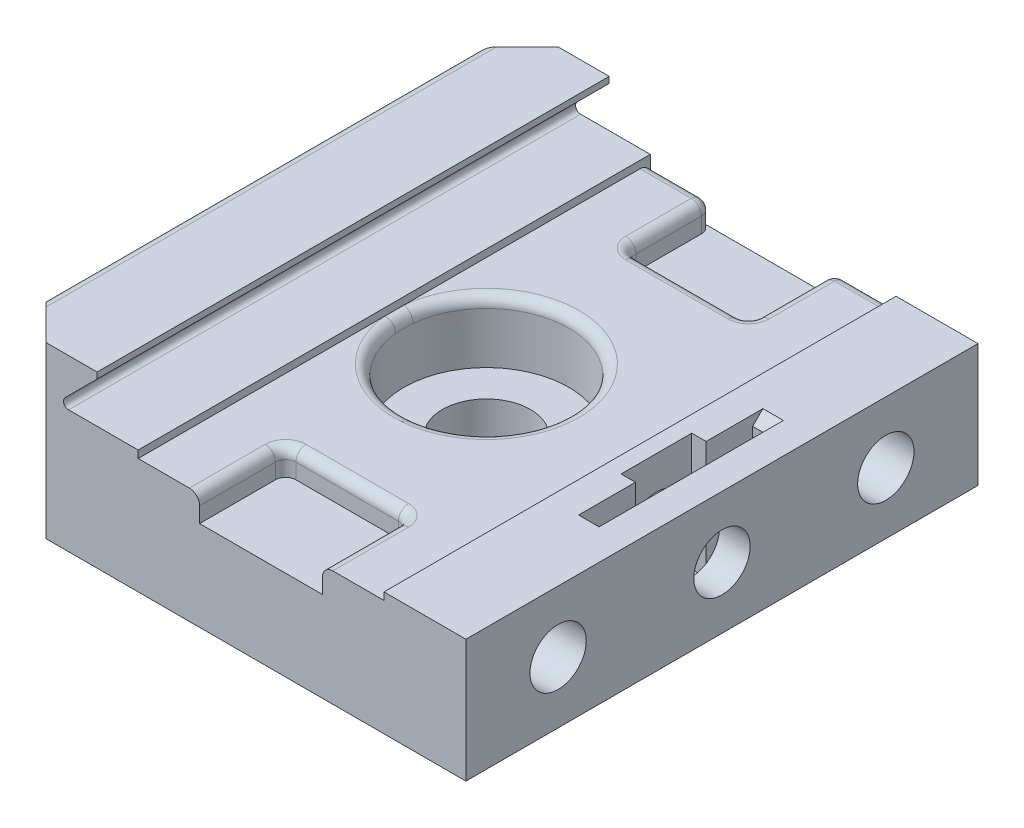
from build123d import *

# Parameters (mm, degrees)
SKETCH1_W            = 45
SKETCH1_H            = 50
BOSS_EXTRUDE1_DEPTH  = 16
CUT_EXTRUDE1_DEPTH   = 58.116109812
SKETCH4_W            = 24
SKETCH4_H            = 50
CUT_EXTRUDE2_DEPTH   = 0.72
CUT_EXTRUDE3_DEPTH   = 58.116109812
SKETCH8_R            = 8.05
CUT_EXTRUDE4_DEPTH   = 6
M8_CLEARANCE_HOLE1_D = 8.6
CUT_EXTRUDE5_DEPTH   = 2.5
FILLET1_R            = 1
FILLET2_R            = 1
FILLET4_R            = 0.5
CUT_EXTRUDE7_DEPTH   = 11.5
SKETCH18_R           = 2.75
CUT_EXTRUDE8_DEPTH   = 14.5
SKETCH19_R           = 2.75
CUT_EXTRUDE9_DEPTH   = 10
SKETCH21_W           = 8.99
SKETCH21_H           = 50
BOSS_EXTRUDE2_DEPTH  = 0.6
CHAMFER1_SIZE        = 4
FILLET5_R            = 1
CHAMFER2_SIZE        = 1


with BuildPart() as part:
    # Sketch1 → Boss-Extrude1 (new body)
    with BuildSketch(Plane(origin=(0, 0, 0), x_dir=(1, 0, 0), z_dir=(0, 1, 0))):
        Rectangle(SKETCH1_W, SKETCH1_H)
    extrude(amount=BOSS_EXTRUDE1_DEPTH)

    # Sketch3 → Cut-Extrude1 (cut, through all)
    with BuildSketch(Plane.XY.offset(25)):
        Polygon((-13.5, 16), (-17.5, 12), (22.5, 12), (22.5, 16), align=None)
    extrude(amount=-CUT_EXTRUDE1_DEPTH, mode=Mode.SUBTRACT)

    # Sketch4 → Cut-Extrude2 (cut)
    with BuildSketch(Plane(origin=(0, 12, 0), x_dir=(1, 0, 0), z_dir=(0, 1, 0))):
        with Locations((2.5, 0)):
            Rectangle(SKETCH4_W, SKETCH4_H)
    extrude(amount=-CUT_EXTRUDE2_DEPTH, mode=Mode.SUBTRACT)

    # Sketch5 → Cut-Extrude3 (cut, through all)
    with BuildSketch(Plane.XY.offset(25)):
        Polygon((-22.5, 16), (-13.5, 16), (-13.51, 15.99), (-22.5, 15.99), align=None)
    extrude(amount=-CUT_EXTRUDE3_DEPTH, mode=Mode.SUBTRACT)

    # Sketch8 → Cut-Extrude4 (cut)
    with BuildSketch(Plane(origin=(0, 11.28, 0), x_dir=(1, 0, 0), z_dir=(0, 1, 0))):
        with Locations(Location((-0.5, 0, 0), (0, 0, 180))):
            Circle(SKETCH8_R)
    extrude(amount=-CUT_EXTRUDE4_DEPTH, mode=Mode.SUBTRACT)

    # M8 Clearance Hole1 (through all)
    with Locations(Plane(origin=(0, 5.28, 0), x_dir=(1, 0, 0), z_dir=(0, 1, 0))):
        with Locations((-0.5, 0)):
            Hole(M8_CLEARANCE_HOLE1_D / 2)

    # Sketch12 → Cut-Extrude5 (cut)
    with BuildSketch(Plane(origin=(0, 11.28, 0), x_dir=(1, 0, 0), z_dir=(0, 1, 0))):
        with BuildLine():
            Line((7.5, 16.6), (-2.5, 16.6))
            ThreePointArc((-2.5, 16.6), (-3.207106781, 16.892893219), (-3.5, 17.6))
            Line((-3.5, 17.6), (-3.5, 25))
            Line((-3.5, 25), (8.5, 25))
            Line((8.5, 25), (8.5, 17.6))
            ThreePointArc((8.5, 17.6), (8.207106781, 16.892893219), (7.5, 16.6))
        make_face()
    cut_extrude5 = extrude(amount=-CUT_EXTRUDE5_DEPTH, mode=Mode.SUBTRACT)

    # Fillet1
    fillet1_edges = [part.edges().sort_by_distance(p)[0] for p in [
        (-3.5, 10.03, -25),
        (8.5, 10.03, -25),
    ]]
    fillet(fillet1_edges, radius=FILLET1_R)

    # Mirror2: Cut-Extrude5 across plane
    add(cut_extrude5.mirror(Plane.XY), mode=Mode.SUBTRACT)

    # Fillet2
    fillet2_edges = [part.edges().sort_by_distance(p)[0] for p in [
        (8.207106781, 11.28, 16.892893219),
        (8.5, 11.28, 21.3),
        (-3.5, 11.28, 21.3),
        (-3.207106781, 11.28, 16.892893219),
        (2.5, 11.28, 16.6),
        (-7, 11.28, -25),
        (7.55, 11.28, 0),
        (8.207106781, 11.28, -16.892893219),
        (8.5, 11.28, -20.8),
        (-3.207106781, 11.28, -16.892893219),
        (2.5, 11.28, -16.6),
        (12, 11.28, -25),
        (-3.5, 11.28, -20.8),
        (-3.792893219, 11.28, -24.707106781),
        (8.792893219, 11.28, -24.707106781),
    ]]
    fillet(fillet2_edges, radius=FILLET2_R)

    # Fillet4
    fillet4_edges = [part.edges().sort_by_distance(p)[0] for p in [
        (-17.5, 12, 0),
    ]]
    fillet(fillet4_edges, radius=FILLET4_R)

    # Sketch14 → Cut-Extrude7 (cut)
    with BuildSketch(Plane(origin=(0, 12, 0), x_dir=(1, 0, 0), z_dir=(0, 1, 0))):
        Polygon((19.5, -8), (17.5, -8), (17.5, -3.45), (16.1, -3.45), (16.1, 3.45), (17.5, 3.45), (17.5, 8), (19.5, 8), align=None)
    extrude(amount=-CUT_EXTRUDE7_DEPTH, mode=Mode.SUBTRACT)

    # Sketch18 → Cut-Extrude8 (cut)
    with BuildSketch(Plane(origin=(22.5, 0, 0), x_dir=(0, 0, -1), z_dir=(1, 0, 0))):
        with Locations((0, 6)):
            Circle(SKETCH18_R)
    extrude(amount=-CUT_EXTRUDE8_DEPTH, mode=Mode.SUBTRACT)

    # Sketch19 → Cut-Extrude9 (cut)
    with BuildSketch(Plane(origin=(22.5, 0, 0), x_dir=(0, 0, -1), z_dir=(1, 0, 0))):
        with Locations((-16, 6)):
            Circle(SKETCH19_R)
        with Locations((16, 6)):
            Circle(SKETCH19_R)
    extrude(amount=-CUT_EXTRUDE9_DEPTH, mode=Mode.SUBTRACT)

    # Sketch21 → Boss-Extrude2 (add)
    with BuildSketch(Plane(origin=(0, 15.99, 0), x_dir=(1, 0, 0), z_dir=(0, 1, 0))):
        with Locations((-18.005, 0)):
            Rectangle(SKETCH21_W, SKETCH21_H)
    extrude(amount=BOSS_EXTRUDE2_DEPTH)

    # Chamfer1
    chamfer1_edges = [part.edges().sort_by_distance(p)[0] for p in [
        (-22.5, 8.295, 25),
        (-22.5, 8.295, -25),
    ]]
    chamfer(chamfer1_edges, length=CHAMFER1_SIZE)

    # Fillet5
    fillet5_edges = [part.edges().sort_by_distance(p)[0] for p in [
        (-22.5, 16.59, 0),
    ]]
    fillet(fillet5_edges, radius=FILLET5_R)

    # Chamfer2
    chamfer2_edges = [part.edges().sort_by_distance(p)[0] for p in [
        (18.5, 12, 8),
        (18.5, 12, -8),
    ]]
    chamfer(chamfer2_edges, length=CHAMFER2_SIZE)


solid = part.part
